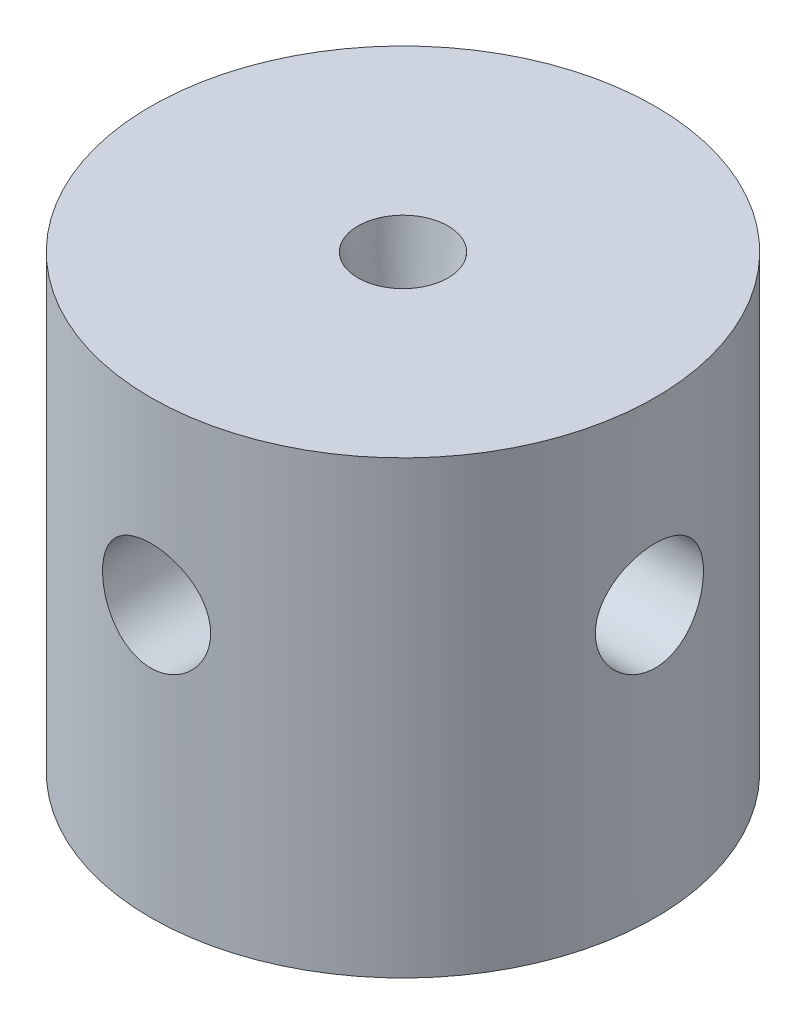
from build123d import *

# Parameters (mm, degrees)
SKETCH2_R          = 3
CUT_EXTRUDE1_DEPTH = 5
CIRPATTERN1_COUNT  = 4


with BuildPart() as part:
    # Sketch1 → Revolve1 (revolve)
    with BuildSketch(Plane.XY):
        Polygon((-1.5, 7.267632686), (-1.5, -7.267632686), (-14, -10.616997592), (-14, 14.383002408), (-2.5, 14.383002408), align=None)
    revolve(axis=Axis((0, 20.798274686, 0), (0, -1, 0)))

    # Sketch2 → Cut-Extrude1 (cut)
    with BuildSketch(Plane(origin=(14, 0, 0), x_dir=(0, 0, -1), z_dir=(1, 0, 0))):
        with Locations((0, 4.383002408)):
            Circle(SKETCH2_R)
    cut_extrude1 = extrude(amount=-CUT_EXTRUDE1_DEPTH, mode=Mode.SUBTRACT)

    # CirPattern1: Cut-Extrude1 ×4 about axis
    cirpattern1_axis = Axis((0, -10.616997592, 0), (0, 1, 0))
    for i in range(1, CIRPATTERN1_COUNT):
        add(cut_extrude1.rotate(cirpattern1_axis, i * 360 / CIRPATTERN1_COUNT), mode=Mode.SUBTRACT)


solid = part.part
